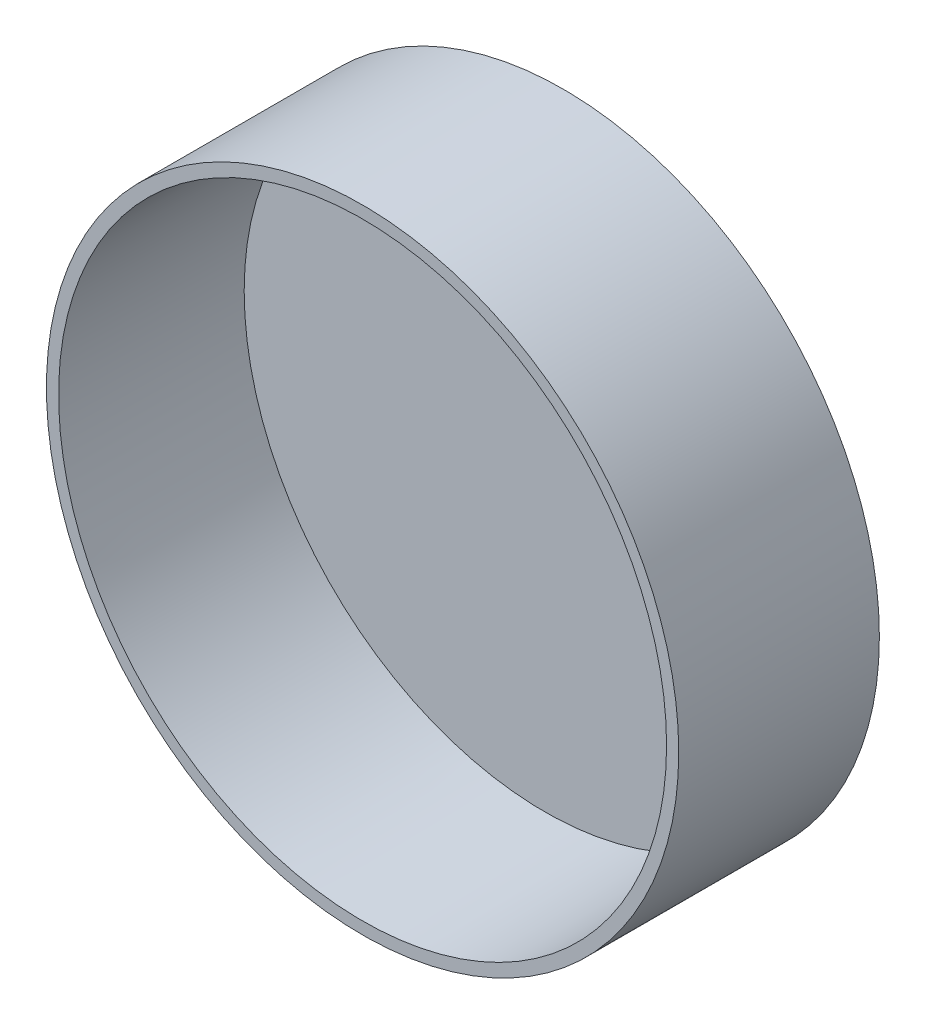
from build123d import *

# Parameters (mm, degrees)
ESQUISSE1_R             = 10.4
BOSS_EXTRU_1_DEPTH      = 6.6
ESQUISSE2_R             = 10
ENL_V_MAT_EXTRU_1_DEPTH = 6
ENL_V_MAT_EXTRU_1_DRAFT = -1


with BuildPart() as part:
    # Esquisse1 → Boss.-Extru.1 (new body)
    with BuildSketch(Plane.XY):
        Circle(ESQUISSE1_R)
    extrude(amount=BOSS_EXTRU_1_DEPTH)


with BuildPart() as enl_v_mat_extru_1_tool:
    # Esquisse2 → Enlèv. mat.-Extru.1 (with draft: the straight prism first)
    with BuildSketch(Plane.XY.offset(6.6)):
        Circle(ESQUISSE2_R)
    extrude(amount=-ENL_V_MAT_EXTRU_1_DEPTH)
    # Enlèv. mat.-Extru.1: the draft: its side faces are tilted about the plane it starts from
    enl_v_mat_extru_1_sides = [enl_v_mat_extru_1_tool.faces().sort_by_distance(p)[0] for p in [
        (-10, 0, 3.6),
    ]]
    draft(enl_v_mat_extru_1_sides, Plane.XY.offset(6.6), ENL_V_MAT_EXTRU_1_DRAFT)


with BuildPart() as part_1:
    add(part.part)

    # Enlèv. mat.-Extru.1: cut by enl_v_mat_extru_1_tool
    add(enl_v_mat_extru_1_tool.part, mode=Mode.SUBTRACT)


solid = part_1.part
